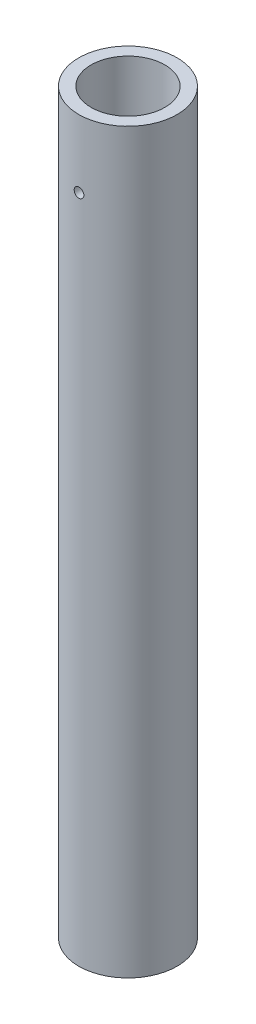
from build123d import *

# Parameters (mm, degrees)
SKETCH2_R               = 10.16
SKETCH2_R_2             = 7.62
BOSS_EXTRUDE1_DEPTH     = 152.4
CUT_EXTRUDE1_DEPTH      = 154.075834801
CUT_EXTRUDE1_DEPTH_BACK = 154.075834801
SKETCH3_R               = 1
SKETCH4_W               = 5.08
SKETCH4_H               = 25.4
CUT_EXTRUDE2_DEPTH      = 154.075834914


with BuildPart() as part:
    # Sketch2 → Boss-Extrude1 (new body)
    with BuildSketch(Plane(origin=(0, 0, 0), x_dir=(1, 0, 0), z_dir=(0, 1, 0))):
        with Locations(Location((0, 0, 0), (0, 0, 90))):
            Circle(SKETCH2_R)
        with Locations(Location((0, 0, 0), (0, 0, 90))):
            Circle(SKETCH2_R_2, mode=Mode.SUBTRACT)
    extrude(amount=BOSS_EXTRUDE1_DEPTH)

    # Sketch3 → Cut-Extrude1 (cut, two sides: drawn at the far end of the back side and taken through both)
    with BuildSketch(Plane.XY.offset(-CUT_EXTRUDE1_DEPTH_BACK)):
        with Locations((0, 138.43)):
            Circle(SKETCH3_R)
    extrude(amount=CUT_EXTRUDE1_DEPTH + CUT_EXTRUDE1_DEPTH_BACK, mode=Mode.SUBTRACT)

    # Sketch4 → Cut-Extrude2 (cut, through all)
    with BuildSketch(Plane.XY):
        with Locations((0, 57.757755026)):
            Rectangle(SKETCH4_W, SKETCH4_H)
    extrude(amount=-CUT_EXTRUDE2_DEPTH, mode=Mode.SUBTRACT)


solid = part.part
